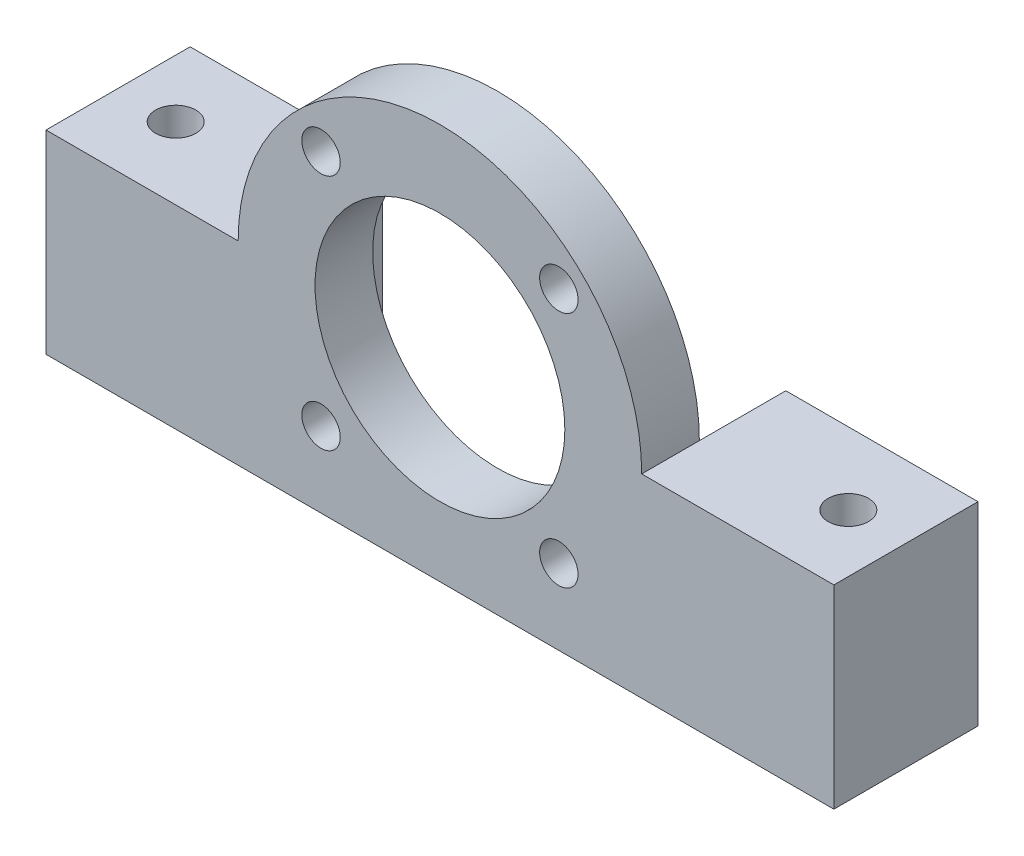
from build123d import *

# Parameters (mm, degrees)
SKETCH_1_R          = 13
SKETCH_1_R_2        = 2
EXTRUDE_1_DEPTH     = 6
SKETCH_2_W          = 20
SKETCH_2_H          = 20.22
EXTRUDE_2_DEPTH     = 15
SKETCH_3_R          = 2.1
CUT_EXTRUDE_1_DEPTH = 47.936126811


with BuildPart() as part:
    # 草图1 → 凸台-拉伸1 (new body)
    with BuildSketch(Plane.XY):
        with BuildLine():
            Line((-21, 20.22), (-21, 0))
            Line((-21, 0), (21, 0))
            Line((21, 0), (21, 20.22))
            ThreePointArc((21, 20.22), (0, 41.22), (-21, 20.22))
        make_face()
        with Locations((0, 20.22)):
            Circle(SKETCH_1_R, mode=Mode.SUBTRACT)
        with Locations((-12.374368671, 32.594368671)):
            Circle(SKETCH_1_R_2, mode=Mode.SUBTRACT)
        with Locations((12.374368671, 32.594368671)):
            Circle(SKETCH_1_R_2, mode=Mode.SUBTRACT)
        with Locations((12.374368671, 7.845631329)):
            Circle(SKETCH_1_R_2, mode=Mode.SUBTRACT)
        with Locations((-12.374368671, 7.845631329)):
            Circle(SKETCH_1_R_2, mode=Mode.SUBTRACT)
    extrude(amount=EXTRUDE_1_DEPTH)

    # 草图2 → 凸台-拉伸2 (add)
    with BuildSketch(Plane.XY.offset(6)):
        with Locations((-31, 10.11)):
            Rectangle(SKETCH_2_W, SKETCH_2_H)
        with Locations((31, 10.11)):
            Rectangle(SKETCH_2_W, SKETCH_2_H)
    extrude(amount=-EXTRUDE_2_DEPTH)

    # 草图3 → 切除-拉伸1 (cut, through all)
    with BuildSketch(Plane(origin=(0, 20.22, 0), x_dir=(1, 0, 0), z_dir=(0, 1, 0))):
        with Locations(Location((-35, 1.5, 0), (0, 0, 180))):
            Circle(SKETCH_3_R)
        with Locations((35, 1.5)):
            Circle(SKETCH_3_R)
    extrude(amount=-CUT_EXTRUDE_1_DEPTH, mode=Mode.SUBTRACT)


solid = part.part
